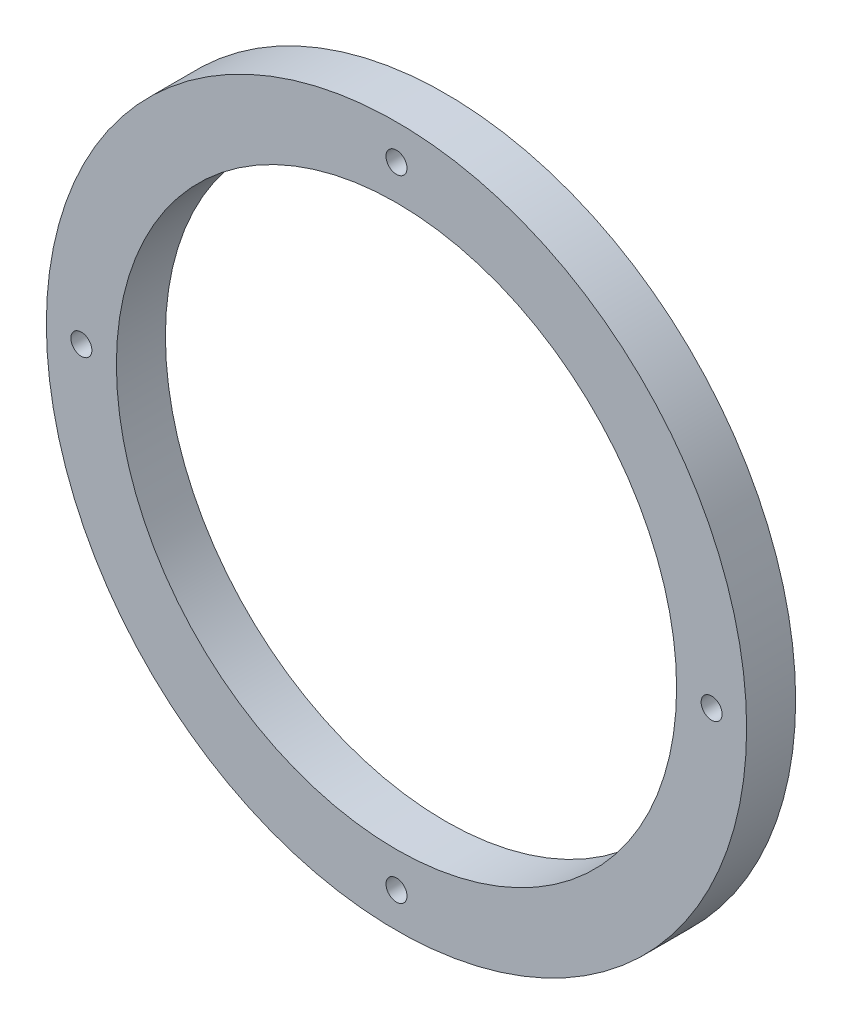
from build123d import *

# Parameters (mm, degrees)
SKETCH1_R           = 50
SKETCH1_R_2         = 40
BOSS_EXTRUDE1_DEPTH = 7
SKETCH2_R           = 1.5
CUT_EXTRUDE1_DEPTH  = 72.056315694


with BuildPart() as part:
    # Sketch1 → Boss-Extrude1 (new body)
    with BuildSketch(Plane.XY):
        Circle(SKETCH1_R)
        Circle(SKETCH1_R_2, mode=Mode.SUBTRACT)
    extrude(amount=BOSS_EXTRUDE1_DEPTH)

    # Sketch2 → Cut-Extrude1 (cut, through all)
    with BuildSketch(Plane.XY.offset(7)):
        with Locations((0, 45)):
            Circle(SKETCH2_R)
        with Locations((0, -45)):
            Circle(SKETCH2_R)
        with Locations((-45, 0)):
            Circle(SKETCH2_R)
        with Locations((45, 0)):
            Circle(SKETCH2_R)
    extrude(amount=-CUT_EXTRUDE1_DEPTH, mode=Mode.SUBTRACT)


solid = part.part
